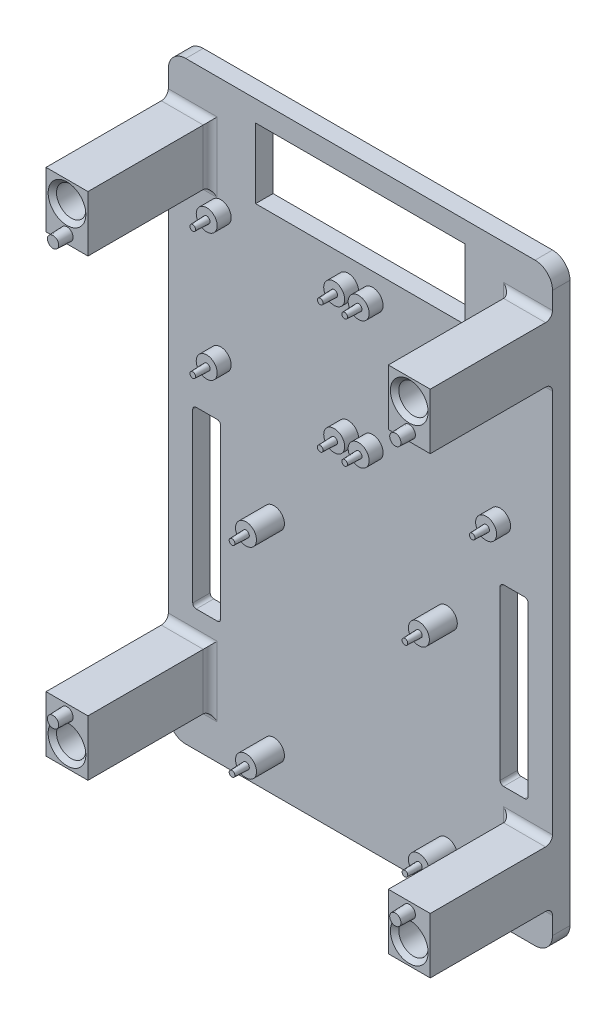
from build123d import *

# Parameters (mm, degrees)
SKIZZE1_W                                 = 110
SKIZZE1_H                                 = 170
AUFSATZ_LINEAR_AUSTRAGEN1_DEPTH           = 5
VERRUNDUNG1_R                             = 5
SKIZZE7_W                                 = 12
SKIZZE7_H                                 = 16
AUFSATZ_LINEAR_AUSTRAGEN3_DEPTH           = 35
VERRUNDUNG2_R                             = 2
SKIZZE8_R                                 = 4.2
SCHNITT_LINEAR_AUSTRAGEN3_DEPTH           = 109.857705285
LINEARES_MUSTER1_COUNT                    = 2
LINEARES_MUSTER1_PITCH                    = 134
LINEARES_MUSTER1_COUNT_DIR2               = 2
LINEARES_MUSTER1_PITCH_DIR2               = 98
SKIZZE9_R                                 = 3
AUFSATZ_LINEAR_AUSTRAGEN4_DEPTH           = 4
SKIZZE10_R                                = 0.95
AUFSATZ_LINEAR_AUSTRAGEN5_DEPTH           = 4
AUFSATZ_LINEAR_AUSTRAGEN5_DRAFT           = 2
AUFSATZ_LINEAR_AUSTRAGEN5_PROFILE_2_DEPTH = 4
AUFSATZ_LINEAR_AUSTRAGEN5_PROFILE_2_DRAFT = 2
AUFSATZ_LINEAR_AUSTRAGEN5_PROFILE_3_DEPTH = 4
AUFSATZ_LINEAR_AUSTRAGEN5_PROFILE_3_DRAFT = 2
AUFSATZ_LINEAR_AUSTRAGEN5_PROFILE_4_DEPTH = 4
AUFSATZ_LINEAR_AUSTRAGEN5_PROFILE_4_DRAFT = 2
AUFSATZ_LINEAR_AUSTRAGEN5_PROFILE_5_DEPTH = 4
AUFSATZ_LINEAR_AUSTRAGEN5_PROFILE_5_DRAFT = 2
AUFSATZ_LINEAR_AUSTRAGEN5_PROFILE_6_DEPTH = 4
AUFSATZ_LINEAR_AUSTRAGEN5_PROFILE_6_DRAFT = 2
AUFSATZ_LINEAR_AUSTRAGEN5_PROFILE_7_DEPTH = 4
AUFSATZ_LINEAR_AUSTRAGEN5_PROFILE_7_DRAFT = 2
AUFSATZ_LINEAR_AUSTRAGEN5_PROFILE_8_DEPTH = 4
AUFSATZ_LINEAR_AUSTRAGEN5_PROFILE_8_DRAFT = 2
FASE1_SIZE                                = 1.2
SKIZZE11_W                                = 60
SKIZZE11_H                                = 20
SCHNITT_LINEAR_AUSTRAGEN4_DEPTH           = 108.121426428
SKIZZE12_R                                = 1.75
AUFSATZ_LINEAR_AUSTRAGEN6_DEPTH           = 4
AUFSATZ_LINEAR_AUSTRAGEN6_DRAFT           = 2
AUFSATZ_LINEAR_AUSTRAGEN6_PROFILE_2_DEPTH = 4
AUFSATZ_LINEAR_AUSTRAGEN6_PROFILE_2_DRAFT = 2
AUFSATZ_LINEAR_AUSTRAGEN6_PROFILE_3_DEPTH = 4
AUFSATZ_LINEAR_AUSTRAGEN6_PROFILE_3_DRAFT = 2
AUFSATZ_LINEAR_AUSTRAGEN6_PROFILE_4_DEPTH = 4
AUFSATZ_LINEAR_AUSTRAGEN6_PROFILE_4_DRAFT = 2
SKIZZE13_R                                = 2
SCHNITT_LINEAR_AUSTRAGEN5_DEPTH           = 4.5
SKIZZE15_W                                = 8
SKIZZE15_H                                = 50
SCHNITT_LINEAR_AUSTRAGEN6_DEPTH           = 109.494239478
VERRUNDUNG3_R                             = 1
SKIZZE16_R                                = 3
AUFSATZ_LINEAR_AUSTRAGEN7_DEPTH           = 4
SKIZZE17_R                                = 0.95
AUFSATZ_LINEAR_AUSTRAGEN8_DEPTH           = 4
AUFSATZ_LINEAR_AUSTRAGEN8_DRAFT           = 2
AUFSATZ_LINEAR_AUSTRAGEN8_PROFILE_2_DEPTH = 4
AUFSATZ_LINEAR_AUSTRAGEN8_PROFILE_2_DRAFT = 2
AUFSATZ_LINEAR_AUSTRAGEN8_PROFILE_3_DEPTH = 4
AUFSATZ_LINEAR_AUSTRAGEN8_PROFILE_3_DRAFT = 2
AUFSATZ_LINEAR_AUSTRAGEN8_PROFILE_4_DEPTH = 4
AUFSATZ_LINEAR_AUSTRAGEN8_PROFILE_4_DRAFT = 2


with BuildPart() as part:
    # Skizze1 → Aufsatz-Linear austragen1 (new body)
    with BuildSketch(Plane.XY):
        Rectangle(SKIZZE1_W, SKIZZE1_H)
    extrude(amount=AUFSATZ_LINEAR_AUSTRAGEN1_DEPTH)

    # Verrundung1
    verrundung1_edges = [part.edges().sort_by_distance(p)[0] for p in [
        (55, -85, 2.5),
        (-55, -85, 2.5),
        (-55, 85, 2.5),
        (55, 85, 2.5),
    ]]
    fillet(verrundung1_edges, radius=VERRUNDUNG1_R)

    # Skizze7 → Aufsatz-Linear austragen3 (add)
    with BuildSketch(Plane.XY.offset(5)):
        with Locations((-49, 65)):
            Rectangle(SKIZZE7_W, SKIZZE7_H)
        with Locations((49, 65)):
            Rectangle(SKIZZE7_W, SKIZZE7_H)
        with Locations((49, -65)):
            Rectangle(SKIZZE7_W, SKIZZE7_H)
        with Locations((-49, -65)):
            Rectangle(SKIZZE7_W, SKIZZE7_H)
    extrude(amount=AUFSATZ_LINEAR_AUSTRAGEN3_DEPTH)

    # Verrundung2
    verrundung2_edges = [part.edges().sort_by_distance(p)[0] for p in [
        (-49, 57, 5),
        (-43, 65, 5),
        (-49, 73, 5),
        (49, 73, 5),
        (43, 65, 5),
        (49, 57, 5),
        (49, -57, 5),
        (43, -65, 5),
        (49, -73, 5),
        (-49, -73, 5),
        (-43, -65, 5),
        (-49, -57, 5),
    ]]
    fillet(verrundung2_edges, radius=VERRUNDUNG2_R)

    # Skizze8 → Schnitt-Linear austragen3 (cut, through all)
    with BuildSketch(Plane.XY.offset(40)):
        with Locations((-49, 67)):
            Circle(SKIZZE8_R)
    schnitt_linear_austragen3 = extrude(amount=-SCHNITT_LINEAR_AUSTRAGEN3_DEPTH, mode=Mode.SUBTRACT)

    # Lineares Muster1: Schnitt-Linear austragen3 2 × 2
    with Locations(*[(j * LINEARES_MUSTER1_PITCH_DIR2, -i * LINEARES_MUSTER1_PITCH, 0) for i in range(LINEARES_MUSTER1_COUNT) for j in range(LINEARES_MUSTER1_COUNT_DIR2) if (i, j) != (0, 0)]):
        add(schnitt_linear_austragen3, mode=Mode.SUBTRACT)

    # Skizze9 → Aufsatz-Linear austragen4 (add)
    with BuildSketch(Plane.XY.offset(5)):
        with Locations(Location((24.75, -73.75, 0), (0, 0, 180))):
            Circle(SKIZZE9_R)
        with Locations(Location((24.75, -16.25, 0), (0, 0, 180))):
            Circle(SKIZZE9_R)
        with Locations(Location((-24.75, -16.25, 0), (0, 0, 180))):
            Circle(SKIZZE9_R)
        with Locations(Location((-24.75, -73.75, 0), (0, 0, 180))):
            Circle(SKIZZE9_R)
        with Locations(Location((-3.5, 52, 0), (0, 0, 180))):
            Circle(SKIZZE9_R)
        with Locations(Location((-40, 52, 0), (0, 0, 180))):
            Circle(SKIZZE9_R)
        with Locations(Location((-40, 15.5, 0), (0, 0, 180))):
            Circle(SKIZZE9_R)
        with Locations(Location((-3.5, 15.5, 0), (0, 0, 180))):
            Circle(SKIZZE9_R)
        with Locations(Location((3.5, 15.5, 0), (0, 0, 180))):
            Circle(SKIZZE9_R)
        with Locations(Location((40, 15.5, 0), (0, 0, 180))):
            Circle(SKIZZE9_R)
        with Locations(Location((40, 52, 0), (0, 0, 180))):
            Circle(SKIZZE9_R)
        with Locations(Location((3.5, 52, 0), (0, 0, 180))):
            Circle(SKIZZE9_R)
    extrude(amount=AUFSATZ_LINEAR_AUSTRAGEN4_DEPTH)


with BuildPart() as aufsatz_linear_austragen5_tool:
    # Skizze10 → Aufsatz-Linear austragen5 (with draft: the straight prism first)
    with BuildSketch(Plane.XY.offset(9)):
        with Locations((3.5, 15.5)):
            Circle(SKIZZE10_R)
    extrude(amount=AUFSATZ_LINEAR_AUSTRAGEN5_DEPTH)
    # Aufsatz-Linear austragen5: the draft: its side faces are tilted about the plane it starts from
    aufsatz_linear_austragen5_sides = [aufsatz_linear_austragen5_tool.faces().sort_by_distance(p)[0] for p in [
        (2.55, 15.5, 11),
    ]]
    draft(aufsatz_linear_austragen5_sides, Plane.XY.offset(9), AUFSATZ_LINEAR_AUSTRAGEN5_DRAFT)


with BuildPart() as part_1:
    add(part.part)

    # Aufsatz-Linear austragen5: add aufsatz_linear_austragen5_tool
    add(aufsatz_linear_austragen5_tool.part)


with BuildPart() as aufsatz_linear_austragen5_profile_2_tool:
    # Skizze10 → Aufsatz-Linear austragen5 profile 2 (with draft: the straight prism first)
    with BuildSketch(Plane.XY.offset(9)):
        with Locations((40, 15.5)):
            Circle(SKIZZE10_R)
    extrude(amount=AUFSATZ_LINEAR_AUSTRAGEN5_PROFILE_2_DEPTH)
    # Aufsatz-Linear austragen5 profile 2: the draft: its side faces are tilted about the plane it starts from
    aufsatz_linear_austragen5_profile_2_sides = [aufsatz_linear_austragen5_profile_2_tool.faces().sort_by_distance(p)[0] for p in [
        (39.05, 15.5, 11),
    ]]
    draft(aufsatz_linear_austragen5_profile_2_sides, Plane.XY.offset(9), AUFSATZ_LINEAR_AUSTRAGEN5_PROFILE_2_DRAFT)


with BuildPart() as part_2:
    add(part_1.part)

    # Aufsatz-Linear austragen5 profile 2: add aufsatz_linear_austragen5_profile_2_tool
    add(aufsatz_linear_austragen5_profile_2_tool.part)


with BuildPart() as aufsatz_linear_austragen5_profile_3_tool:
    # Skizze10 → Aufsatz-Linear austragen5 profile 3 (with draft: the straight prism first)
    with BuildSketch(Plane.XY.offset(9)):
        with Locations((40, 52)):
            Circle(SKIZZE10_R)
    extrude(amount=AUFSATZ_LINEAR_AUSTRAGEN5_PROFILE_3_DEPTH)
    # Aufsatz-Linear austragen5 profile 3: the draft: its side faces are tilted about the plane it starts from
    aufsatz_linear_austragen5_profile_3_sides = [aufsatz_linear_austragen5_profile_3_tool.faces().sort_by_distance(p)[0] for p in [
        (39.05, 52, 11),
    ]]
    draft(aufsatz_linear_austragen5_profile_3_sides, Plane.XY.offset(9), AUFSATZ_LINEAR_AUSTRAGEN5_PROFILE_3_DRAFT)


with BuildPart() as part_3:
    add(part_2.part)

    # Aufsatz-Linear austragen5 profile 3: add aufsatz_linear_austragen5_profile_3_tool
    add(aufsatz_linear_austragen5_profile_3_tool.part)


with BuildPart() as aufsatz_linear_austragen5_profile_4_tool:
    # Skizze10 → Aufsatz-Linear austragen5 profile 4 (with draft: the straight prism first)
    with BuildSketch(Plane.XY.offset(9)):
        with Locations((3.5, 52)):
            Circle(SKIZZE10_R)
    extrude(amount=AUFSATZ_LINEAR_AUSTRAGEN5_PROFILE_4_DEPTH)
    # Aufsatz-Linear austragen5 profile 4: the draft: its side faces are tilted about the plane it starts from
    aufsatz_linear_austragen5_profile_4_sides = [aufsatz_linear_austragen5_profile_4_tool.faces().sort_by_distance(p)[0] for p in [
        (2.55, 52, 11),
    ]]
    draft(aufsatz_linear_austragen5_profile_4_sides, Plane.XY.offset(9), AUFSATZ_LINEAR_AUSTRAGEN5_PROFILE_4_DRAFT)


with BuildPart() as part_4:
    add(part_3.part)

    # Aufsatz-Linear austragen5 profile 4: add aufsatz_linear_austragen5_profile_4_tool
    add(aufsatz_linear_austragen5_profile_4_tool.part)


with BuildPart() as aufsatz_linear_austragen5_profile_5_tool:
    # Skizze10 → Aufsatz-Linear austragen5 profile 5 (with draft: the straight prism first)
    with BuildSketch(Plane.XY.offset(9)):
        with Locations((-3.5, 52)):
            Circle(SKIZZE10_R)
    extrude(amount=AUFSATZ_LINEAR_AUSTRAGEN5_PROFILE_5_DEPTH)
    # Aufsatz-Linear austragen5 profile 5: the draft: its side faces are tilted about the plane it starts from
    aufsatz_linear_austragen5_profile_5_sides = [aufsatz_linear_austragen5_profile_5_tool.faces().sort_by_distance(p)[0] for p in [
        (-4.45, 52, 11),
    ]]
    draft(aufsatz_linear_austragen5_profile_5_sides, Plane.XY.offset(9), AUFSATZ_LINEAR_AUSTRAGEN5_PROFILE_5_DRAFT)


with BuildPart() as part_5:
    add(part_4.part)

    # Aufsatz-Linear austragen5 profile 5: add aufsatz_linear_austragen5_profile_5_tool
    add(aufsatz_linear_austragen5_profile_5_tool.part)


with BuildPart() as aufsatz_linear_austragen5_profile_6_tool:
    # Skizze10 → Aufsatz-Linear austragen5 profile 6 (with draft: the straight prism first)
    with BuildSketch(Plane.XY.offset(9)):
        with Locations((-40, 52)):
            Circle(SKIZZE10_R)
    extrude(amount=AUFSATZ_LINEAR_AUSTRAGEN5_PROFILE_6_DEPTH)
    # Aufsatz-Linear austragen5 profile 6: the draft: its side faces are tilted about the plane it starts from
    aufsatz_linear_austragen5_profile_6_sides = [aufsatz_linear_austragen5_profile_6_tool.faces().sort_by_distance(p)[0] for p in [
        (-40.95, 52, 11),
    ]]
    draft(aufsatz_linear_austragen5_profile_6_sides, Plane.XY.offset(9), AUFSATZ_LINEAR_AUSTRAGEN5_PROFILE_6_DRAFT)


with BuildPart() as part_6:
    add(part_5.part)

    # Aufsatz-Linear austragen5 profile 6: add aufsatz_linear_austragen5_profile_6_tool
    add(aufsatz_linear_austragen5_profile_6_tool.part)


with BuildPart() as aufsatz_linear_austragen5_profile_7_tool:
    # Skizze10 → Aufsatz-Linear austragen5 profile 7 (with draft: the straight prism first)
    with BuildSketch(Plane.XY.offset(9)):
        with Locations((-40, 15.5)):
            Circle(SKIZZE10_R)
    extrude(amount=AUFSATZ_LINEAR_AUSTRAGEN5_PROFILE_7_DEPTH)
    # Aufsatz-Linear austragen5 profile 7: the draft: its side faces are tilted about the plane it starts from
    aufsatz_linear_austragen5_profile_7_sides = [aufsatz_linear_austragen5_profile_7_tool.faces().sort_by_distance(p)[0] for p in [
        (-40.95, 15.5, 11),
    ]]
    draft(aufsatz_linear_austragen5_profile_7_sides, Plane.XY.offset(9), AUFSATZ_LINEAR_AUSTRAGEN5_PROFILE_7_DRAFT)


with BuildPart() as part_7:
    add(part_6.part)

    # Aufsatz-Linear austragen5 profile 7: add aufsatz_linear_austragen5_profile_7_tool
    add(aufsatz_linear_austragen5_profile_7_tool.part)


with BuildPart() as aufsatz_linear_austragen5_profile_8_tool:
    # Skizze10 → Aufsatz-Linear austragen5 profile 8 (with draft: the straight prism first)
    with BuildSketch(Plane.XY.offset(9)):
        with Locations((-3.5, 15.5)):
            Circle(SKIZZE10_R)
    extrude(amount=AUFSATZ_LINEAR_AUSTRAGEN5_PROFILE_8_DEPTH)
    # Aufsatz-Linear austragen5 profile 8: the draft: its side faces are tilted about the plane it starts from
    aufsatz_linear_austragen5_profile_8_sides = [aufsatz_linear_austragen5_profile_8_tool.faces().sort_by_distance(p)[0] for p in [
        (-4.45, 15.5, 11),
    ]]
    draft(aufsatz_linear_austragen5_profile_8_sides, Plane.XY.offset(9), AUFSATZ_LINEAR_AUSTRAGEN5_PROFILE_8_DRAFT)


with BuildPart() as part_8:
    add(part_7.part)

    # Aufsatz-Linear austragen5 profile 8: add aufsatz_linear_austragen5_profile_8_tool
    add(aufsatz_linear_austragen5_profile_8_tool.part)

    # Fase1
    fase1_edges = [part_8.edges().sort_by_distance(p)[0] for p in [
        (-53.2, 67, 40),
        (44.8, 67, 40),
        (-53.2, -67, 40),
        (44.8, -67, 40),
    ]]
    chamfer(fase1_edges, length=FASE1_SIZE)

    # Skizze11 → Schnitt-Linear austragen4 (cut, through all)
    with BuildSketch(Plane.XY.offset(5)):
        with Locations((0, 69)):
            Rectangle(SKIZZE11_W, SKIZZE11_H)
    extrude(amount=-SCHNITT_LINEAR_AUSTRAGEN4_DEPTH, mode=Mode.SUBTRACT)


with BuildPart() as aufsatz_linear_austragen6_tool:
    # Skizze12 → Aufsatz-Linear austragen6 (with draft: the straight prism first)
    with BuildSketch(Plane.XY.offset(40)):
        with Locations((-49, 59.5)):
            Circle(SKIZZE12_R)
    extrude(amount=AUFSATZ_LINEAR_AUSTRAGEN6_DEPTH)
    # Aufsatz-Linear austragen6: the draft: its side faces are tilted about the plane it starts from
    aufsatz_linear_austragen6_sides = [aufsatz_linear_austragen6_tool.faces().sort_by_distance(p)[0] for p in [
        (-50.75, 59.5, 42),
    ]]
    draft(aufsatz_linear_austragen6_sides, Plane.XY.offset(40), AUFSATZ_LINEAR_AUSTRAGEN6_DRAFT)


with BuildPart() as part_9:
    add(part_8.part)

    # Aufsatz-Linear austragen6: add aufsatz_linear_austragen6_tool
    add(aufsatz_linear_austragen6_tool.part)


with BuildPart() as aufsatz_linear_austragen6_profile_2_tool:
    # Skizze12 → Aufsatz-Linear austragen6 profile 2 (with draft: the straight prism first)
    with BuildSketch(Plane.XY.offset(40)):
        with Locations((49, 59.5)):
            Circle(SKIZZE12_R)
    extrude(amount=AUFSATZ_LINEAR_AUSTRAGEN6_PROFILE_2_DEPTH)
    # Aufsatz-Linear austragen6 profile 2: the draft: its side faces are tilted about the plane it starts from
    aufsatz_linear_austragen6_profile_2_sides = [aufsatz_linear_austragen6_profile_2_tool.faces().sort_by_distance(p)[0] for p in [
        (47.25, 59.5, 42),
    ]]
    draft(aufsatz_linear_austragen6_profile_2_sides, Plane.XY.offset(40), AUFSATZ_LINEAR_AUSTRAGEN6_PROFILE_2_DRAFT)


with BuildPart() as part_10:
    add(part_9.part)

    # Aufsatz-Linear austragen6 profile 2: add aufsatz_linear_austragen6_profile_2_tool
    add(aufsatz_linear_austragen6_profile_2_tool.part)


with BuildPart() as aufsatz_linear_austragen6_profile_3_tool:
    # Skizze12 → Aufsatz-Linear austragen6 profile 3 (with draft: the straight prism first)
    with BuildSketch(Plane.XY.offset(40)):
        with Locations((-49, -59.5)):
            Circle(SKIZZE12_R)
    extrude(amount=AUFSATZ_LINEAR_AUSTRAGEN6_PROFILE_3_DEPTH)
    # Aufsatz-Linear austragen6 profile 3: the draft: its side faces are tilted about the plane it starts from
    aufsatz_linear_austragen6_profile_3_sides = [aufsatz_linear_austragen6_profile_3_tool.faces().sort_by_distance(p)[0] for p in [
        (-50.75, -59.5, 42),
    ]]
    draft(aufsatz_linear_austragen6_profile_3_sides, Plane.XY.offset(40), AUFSATZ_LINEAR_AUSTRAGEN6_PROFILE_3_DRAFT)


with BuildPart() as part_11:
    add(part_10.part)

    # Aufsatz-Linear austragen6 profile 3: add aufsatz_linear_austragen6_profile_3_tool
    add(aufsatz_linear_austragen6_profile_3_tool.part)


with BuildPart() as aufsatz_linear_austragen6_profile_4_tool:
    # Skizze12 → Aufsatz-Linear austragen6 profile 4 (with draft: the straight prism first)
    with BuildSketch(Plane.XY.offset(40)):
        with Locations((49, -59.5)):
            Circle(SKIZZE12_R)
    extrude(amount=AUFSATZ_LINEAR_AUSTRAGEN6_PROFILE_4_DEPTH)
    # Aufsatz-Linear austragen6 profile 4: the draft: its side faces are tilted about the plane it starts from
    aufsatz_linear_austragen6_profile_4_sides = [aufsatz_linear_austragen6_profile_4_tool.faces().sort_by_distance(p)[0] for p in [
        (47.25, -59.5, 42),
    ]]
    draft(aufsatz_linear_austragen6_profile_4_sides, Plane.XY.offset(40), AUFSATZ_LINEAR_AUSTRAGEN6_PROFILE_4_DRAFT)


with BuildPart() as part_12:
    add(part_11.part)

    # Aufsatz-Linear austragen6 profile 4: add aufsatz_linear_austragen6_profile_4_tool
    add(aufsatz_linear_austragen6_profile_4_tool.part)

    # Skizze13 → Schnitt-Linear austragen5 (cut)
    with BuildSketch(Plane(origin=(0, 0, 0), x_dir=(-1, 0, 0), z_dir=(0, 0, -1))):
        with Locations((49, 59.5)):
            Circle(SKIZZE13_R)
        with Locations(Location((-49, 59.5, 0), (0, 0, 180))):
            Circle(SKIZZE13_R)
        with Locations((-49, -59.5)):
            Circle(SKIZZE13_R)
        with Locations(Location((49, -59.5, 0), (0, 0, 180))):
            Circle(SKIZZE13_R)
    extrude(amount=-SCHNITT_LINEAR_AUSTRAGEN5_DEPTH, mode=Mode.SUBTRACT)

    # Skizze15 → Schnitt-Linear austragen6 (cut, through all)
    with BuildSketch(Plane.XY.offset(5)):
        with Locations((44, -25)):
            Rectangle(SKIZZE15_W, SKIZZE15_H)
        with Locations((-44, -25)):
            Rectangle(SKIZZE15_W, SKIZZE15_H)
    extrude(amount=-SCHNITT_LINEAR_AUSTRAGEN6_DEPTH, mode=Mode.SUBTRACT)

    # Verrundung3
    verrundung3_edges = [part_12.edges().sort_by_distance(p)[0] for p in [
        (48, 0, 2.5),
        (48, -50, 2.5),
        (40, -50, 2.5),
        (40, 0, 2.5),
        (-48, -50, 2.5),
        (-48, 0, 2.5),
        (-40, 0, 2.5),
        (-40, -50, 2.5),
    ]]
    fillet(verrundung3_edges, radius=VERRUNDUNG3_R)

    # Skizze16 → Aufsatz-Linear austragen7 (add)
    with BuildSketch(Plane.XY.offset(9)):
        with Locations(Location((-24.75, -16.25, 0), (0, 0, 180))):
            Circle(SKIZZE16_R)
        with Locations(Location((24.75, -16.25, 0), (0, 0, 180))):
            Circle(SKIZZE16_R)
        with Locations(Location((-24.75, -73.75, 0), (0, 0, 180))):
            Circle(SKIZZE16_R)
        with Locations(Location((24.75, -73.75, 0), (0, 0, 180))):
            Circle(SKIZZE16_R)
    extrude(amount=AUFSATZ_LINEAR_AUSTRAGEN7_DEPTH)


with BuildPart() as aufsatz_linear_austragen8_tool:
    # Skizze17 → Aufsatz-Linear austragen8 (with draft: the straight prism first)
    with BuildSketch(Plane.XY.offset(13)):
        with Locations((-24.75, -16.25)):
            Circle(SKIZZE17_R)
    extrude(amount=AUFSATZ_LINEAR_AUSTRAGEN8_DEPTH)
    # Aufsatz-Linear austragen8: the draft: its side faces are tilted about the plane it starts from
    aufsatz_linear_austragen8_sides = [aufsatz_linear_austragen8_tool.faces().sort_by_distance(p)[0] for p in [
        (-25.7, -16.25, 15),
    ]]
    draft(aufsatz_linear_austragen8_sides, Plane.XY.offset(13), AUFSATZ_LINEAR_AUSTRAGEN8_DRAFT)


with BuildPart() as part_13:
    add(part_12.part)

    # Aufsatz-Linear austragen8: add aufsatz_linear_austragen8_tool
    add(aufsatz_linear_austragen8_tool.part)


with BuildPart() as aufsatz_linear_austragen8_profile_2_tool:
    # Skizze17 → Aufsatz-Linear austragen8 profile 2 (with draft: the straight prism first)
    with BuildSketch(Plane.XY.offset(13)):
        with Locations((24.75, -16.25)):
            Circle(SKIZZE17_R)
    extrude(amount=AUFSATZ_LINEAR_AUSTRAGEN8_PROFILE_2_DEPTH)
    # Aufsatz-Linear austragen8 profile 2: the draft: its side faces are tilted about the plane it starts from
    aufsatz_linear_austragen8_profile_2_sides = [aufsatz_linear_austragen8_profile_2_tool.faces().sort_by_distance(p)[0] for p in [
        (23.8, -16.25, 15),
    ]]
    draft(aufsatz_linear_austragen8_profile_2_sides, Plane.XY.offset(13), AUFSATZ_LINEAR_AUSTRAGEN8_PROFILE_2_DRAFT)


with BuildPart() as part_14:
    add(part_13.part)

    # Aufsatz-Linear austragen8 profile 2: add aufsatz_linear_austragen8_profile_2_tool
    add(aufsatz_linear_austragen8_profile_2_tool.part)


with BuildPart() as aufsatz_linear_austragen8_profile_3_tool:
    # Skizze17 → Aufsatz-Linear austragen8 profile 3 (with draft: the straight prism first)
    with BuildSketch(Plane.XY.offset(13)):
        with Locations((-24.75, -73.75)):
            Circle(SKIZZE17_R)
    extrude(amount=AUFSATZ_LINEAR_AUSTRAGEN8_PROFILE_3_DEPTH)
    # Aufsatz-Linear austragen8 profile 3: the draft: its side faces are tilted about the plane it starts from
    aufsatz_linear_austragen8_profile_3_sides = [aufsatz_linear_austragen8_profile_3_tool.faces().sort_by_distance(p)[0] for p in [
        (-25.7, -73.75, 15),
    ]]
    draft(aufsatz_linear_austragen8_profile_3_sides, Plane.XY.offset(13), AUFSATZ_LINEAR_AUSTRAGEN8_PROFILE_3_DRAFT)


with BuildPart() as part_15:
    add(part_14.part)

    # Aufsatz-Linear austragen8 profile 3: add aufsatz_linear_austragen8_profile_3_tool
    add(aufsatz_linear_austragen8_profile_3_tool.part)


with BuildPart() as aufsatz_linear_austragen8_profile_4_tool:
    # Skizze17 → Aufsatz-Linear austragen8 profile 4 (with draft: the straight prism first)
    with BuildSketch(Plane.XY.offset(13)):
        with Locations((24.75, -73.75)):
            Circle(SKIZZE17_R)
    extrude(amount=AUFSATZ_LINEAR_AUSTRAGEN8_PROFILE_4_DEPTH)
    # Aufsatz-Linear austragen8 profile 4: the draft: its side faces are tilted about the plane it starts from
    aufsatz_linear_austragen8_profile_4_sides = [aufsatz_linear_austragen8_profile_4_tool.faces().sort_by_distance(p)[0] for p in [
        (23.8, -73.75, 15),
    ]]
    draft(aufsatz_linear_austragen8_profile_4_sides, Plane.XY.offset(13), AUFSATZ_LINEAR_AUSTRAGEN8_PROFILE_4_DRAFT)


with BuildPart() as part_16:
    add(part_15.part)

    # Aufsatz-Linear austragen8 profile 4: add aufsatz_linear_austragen8_profile_4_tool
    add(aufsatz_linear_austragen8_profile_4_tool.part)


solid = part_16.part
